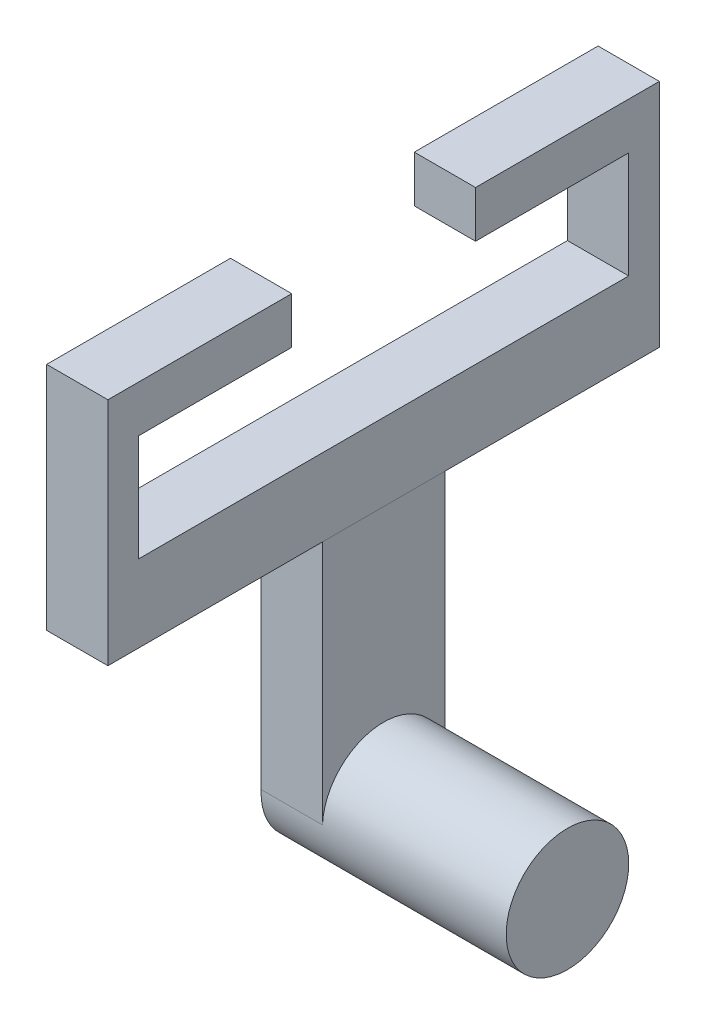
from build123d import *

# Parameters (mm, degrees)
SKETCH2_R           = 12.7
BOSS_EXTRUDE1_DEPTH = 50.8
SKETCH3_W           = 25.4
SKETCH3_H           = 50.8
BOSS_EXTRUDE2_DEPTH = 12.7
SKETCH5_W           = 101.6
SKETCH5_H           = 16.002
BOSS_EXTRUDE3_DEPTH = 12.7
SKETCH6_W           = 6.35
SKETCH6_H           = 38.1
BOSS_EXTRUDE4_DEPTH = 12.7
SKETCH7_W           = 38.1
SKETCH7_H           = 9.652
BOSS_EXTRUDE5_DEPTH = 12.7


with BuildPart() as part:
    # Sketch2 → Boss-Extrude1 (new body)
    with BuildSketch(Plane(origin=(0, 0, 0), x_dir=(0, 0, -1), z_dir=(1, 0, 0))):
        Circle(SKETCH2_R)
    extrude(amount=BOSS_EXTRUDE1_DEPTH)

    # Sketch3 → Boss-Extrude2 (add)
    with BuildSketch(Plane.ZY):
        with Locations((0.014597196, 26.008732875)):
            Rectangle(SKETCH3_W, SKETCH3_H)
    extrude(amount=-BOSS_EXTRUDE2_DEPTH)


with BuildPart() as body_2:
    # Sketch5 → Boss-Extrude3 (new body)
    with BuildSketch(Plane(origin=(0, 0, 0), x_dir=(0, 0, -1), z_dir=(1, 0, 0))):
        with Locations((0, 59.392294155)):
            Rectangle(SKETCH5_W, SKETCH5_H)
    extrude(amount=BOSS_EXTRUDE3_DEPTH)

    # Sketch6 → Boss-Extrude4 (add)
    with BuildSketch(Plane(origin=(0, 0, 0), x_dir=(0, 0, -1), z_dir=(1, 0, 0))):
        with Locations((-53.975, 70.441294155)):
            Rectangle(SKETCH6_W, SKETCH6_H)
        with Locations((53.975, 70.441294155)):
            Rectangle(SKETCH6_W, SKETCH6_H)
    extrude(amount=BOSS_EXTRUDE4_DEPTH)

    # Sketch7 → Boss-Extrude5 (add)
    with BuildSketch(Plane(origin=(0, 0, 0), x_dir=(0, 0, -1), z_dir=(1, 0, 0))):
        with Locations((-38.1, 94.317294155)):
            Rectangle(SKETCH7_W, SKETCH7_H)
        with Locations((38.1, 94.317294155)):
            Rectangle(SKETCH7_W, SKETCH7_H)
    extrude(amount=BOSS_EXTRUDE5_DEPTH)


solid = Compound([part.part, body_2.part])
